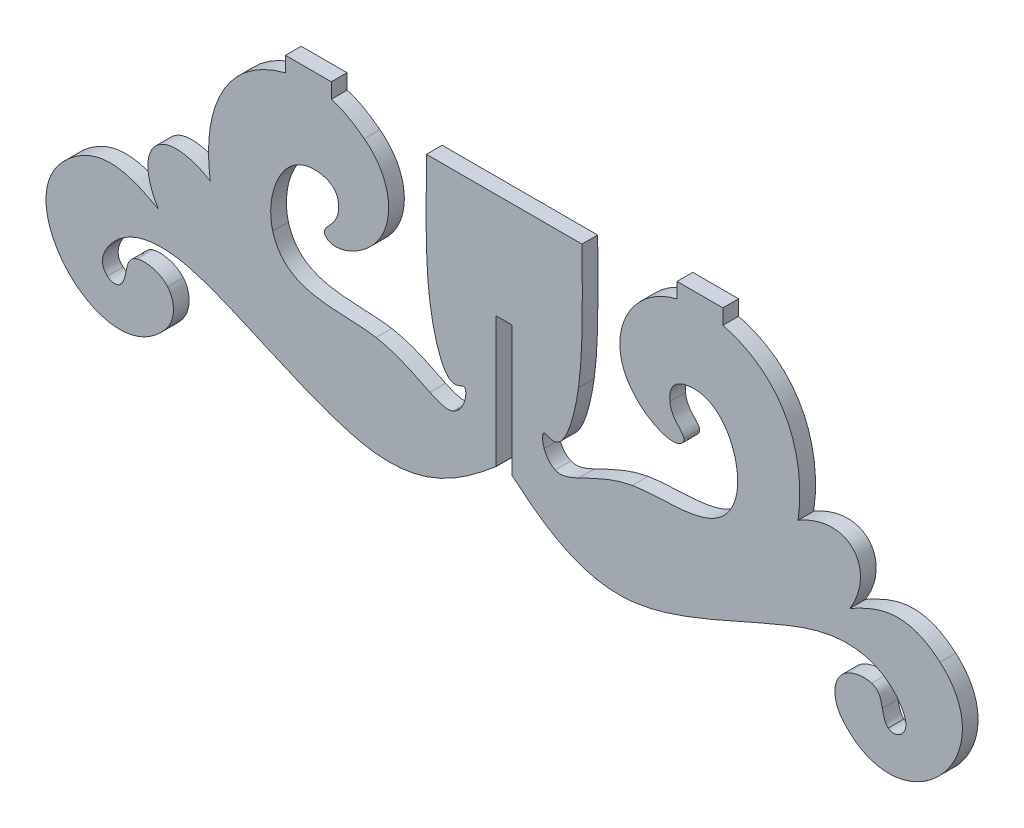
from build123d import *

# Parameters (mm, degrees)
RESSALTO_EXTRUS_O3_DEPTH = 2


with BuildPart() as part:
    # Model → Ressalto-extrusão3 (new body)
    with BuildSketch(Plane.XY):
        with BuildLine():
            Line((2.6789, 71.0422), (4.7123, 71.0422))
            Line((4.7123, 71.0422), (4.7123, 54.4506))
            Line((4.7123, 54.4506), (4.6872, 54.4506))
            add(Edge.make_bspline(
                [(4.6872, 54.4506), (9.062, 50.7507), (13.7394, 47.386), (20.3781, 48.2488)],
                knots=[0.027777778, 0.027777778, 0.027777778, 0.027777778, 0.041666667, 0.041666667, 0.041666667, 0.041666667], degree=3))
            add(Edge.make_bspline(
                [(20.3781, 48.2488), (27.5885, 49.1858), (37.2734, 55.11), (43.5948, 56.7666)],
                knots=[0.041666667, 0.041666667, 0.041666667, 0.041666667, 0.055555556, 0.055555556, 0.055555556, 0.055555556], degree=3))
            add(Edge.make_bspline(
                [(43.5948, 56.7666), (49.9162, 58.4234), (52.8741, 55.8127), (54.0948, 54.0027)],
                knots=[0.055555556, 0.055555556, 0.055555556, 0.055555556, 0.069444444, 0.069444444, 0.069444444, 0.069444444], degree=3))
            add(Edge.make_bspline(
                [(54.0948, 54.0027), (55.3154, 52.1926), (54.7989, 51.1833), (54.2189, 50.6878)],
                knots=[0.069444444, 0.069444444, 0.069444444, 0.069444444, 0.083333333, 0.083333333, 0.083333333, 0.083333333], degree=3))
            add(Edge.make_bspline(
                [(54.2189, 50.6878), (53.6389, 50.1923), (52.9955, 50.2106), (52.5865, 50.5521)],
                knots=[0.083333333, 0.083333333, 0.083333333, 0.083333333, 0.097222222, 0.097222222, 0.097222222, 0.097222222], degree=3))
            add(Edge.make_bspline(
                [(52.5865, 50.5521), (52.1774, 50.8936), (52.0028, 51.5583), (51.8381, 52.3634)],
                knots=[0.097222222, 0.097222222, 0.097222222, 0.097222222, 0.111111111, 0.111111111, 0.111111111, 0.111111111], degree=3))
            add(Edge.make_bspline(
                [(51.8381, 52.3634), (51.6733, 53.1686), (51.5184, 54.1141), (50.4808, 54.4478)],
                knots=[0.111111111, 0.111111111, 0.111111111, 0.111111111, 0.125, 0.125, 0.125, 0.125], degree=3))
            add(Edge.make_bspline(
                [(50.4808, 54.4478), (49.4432, 54.7814), (47.5229, 54.5032), (46.5324, 53.3213)],
                knots=[0.125, 0.125, 0.125, 0.125, 0.138888889, 0.138888889, 0.138888889, 0.138888889], degree=3))
            add(Edge.make_bspline(
                [(46.5324, 53.3213), (45.5419, 52.1394), (45.4813, 50.0538), (46.8609, 48.4462)],
                knots=[0.138888889, 0.138888889, 0.138888889, 0.138888889, 0.152777778, 0.152777778, 0.152777778, 0.152777778], degree=3))
            add(Edge.make_bspline(
                [(46.8609, 48.4462), (54.5024, 39.5417), (67.8873, 53.5286), (59.1979, 61.1094)],
                knots=[0.152777778, 0.152777778, 0.152777778, 0.152777778, 0.166666667, 0.166666667, 0.166666667, 0.166666667], degree=3))
            add(Edge.make_bspline(
                [(59.1979, 61.1094), (54.8331, 64.9174), (51.0322, 63.0994), (47.7303, 61.3186)],
                knots=[0.166666667, 0.166666667, 0.166666667, 0.166666667, 0.180555556, 0.180555556, 0.180555556, 0.180555556], degree=3))
            add(Edge.make_bspline(
                [(47.7303, 61.3186), (51.1536, 66.909), (47.6105, 71.4976), (41.1094, 67.7169)],
                knots=[0.180555556, 0.180555556, 0.180555556, 0.180555556, 0.194444444, 0.194444444, 0.194444444, 0.194444444], degree=3))
            add(Edge.make_bspline(
                [(41.1094, 67.7169), (42.1976, 75.1571), (39.464, 82.3954), (31.5377, 84.4254)],
                knots=[0.194444444, 0.194444444, 0.194444444, 0.194444444, 0.208333333, 0.208333333, 0.208333333, 0.208333333], degree=3))
            Line((31.5377, 84.4254), (31.5377, 86.3583))
            Line((31.5377, 86.3583), (25.7044, 86.3583))
            Line((25.7044, 86.3583), (25.7044, 84.4254))
            add(Edge.make_bspline(
                [(25.7044, 84.4254), (18.8302, 82.7817), (15.2664, 74.1022), (22.078, 69.5651)],
                knots=[0.25, 0.25, 0.25, 0.25, 0.263888889, 0.263888889, 0.263888889, 0.263888889], degree=3))
            add(Edge.make_bspline(
                [(22.078, 69.5651), (23.2846, 68.7615), (24.5438, 68.3933), (25.3837, 68.4581)],
                knots=[0.263888889, 0.263888889, 0.263888889, 0.263888889, 0.277777778, 0.277777778, 0.277777778, 0.277777778], degree=3))
            add(Edge.make_bspline(
                [(25.3837, 68.4581), (26.2235, 68.523), (26.6439, 69.0208), (26.5749, 69.4768)],
                knots=[0.277777778, 0.277777778, 0.277777778, 0.277777778, 0.291666667, 0.291666667, 0.291666667, 0.291666667], degree=3))
            add(Edge.make_bspline(
                [(26.5749, 69.4768), (26.4546, 70.2717), (24.9711, 70.8288), (24.7886, 72.6586)],
                knots=[0.291666667, 0.291666667, 0.291666667, 0.291666667, 0.305555556, 0.305555556, 0.305555556, 0.305555556], degree=3))
            add(Edge.make_bspline(
                [(24.7886, 72.6586), (24.5774, 74.7766), (26.0542, 75.6463), (28.0005, 75.5977)],
                knots=[0.305555556, 0.305555556, 0.305555556, 0.305555556, 0.319444444, 0.319444444, 0.319444444, 0.319444444], degree=3))
            add(Edge.make_bspline(
                [(28.0005, 75.5977), (32.2189, 75.4923), (34.1657, 69.6758), (33.1666, 66.1718)],
                knots=[0.319444444, 0.319444444, 0.319444444, 0.319444444, 0.333333333, 0.333333333, 0.333333333, 0.333333333], degree=3))
            add(Edge.make_bspline(
                [(33.1666, 66.1718), (31.4794, 60.2548), (24.54, 61.8192), (19.997, 61.0131)],
                knots=[0.333333333, 0.333333333, 0.333333333, 0.333333333, 0.347222222, 0.347222222, 0.347222222, 0.347222222], degree=3))
            add(Edge.make_bspline(
                [(19.997, 61.0131), (17.1907, 60.5153), (14.7474, 59.143), (13.1565, 58.3983)],
                knots=[0.347222222, 0.347222222, 0.347222222, 0.347222222, 0.361111111, 0.361111111, 0.361111111, 0.361111111], degree=3))
            add(Edge.make_bspline(
                [(13.1565, 58.3983), (11.5657, 57.6536), (10.8273, 57.5364), (10.1985, 57.8083)],
                knots=[0.361111111, 0.361111111, 0.361111111, 0.361111111, 0.375, 0.375, 0.375, 0.375], degree=3))
            add(Edge.make_bspline(
                [(10.1985, 57.8083), (9.5697, 58.0801), (9.0504, 58.7408), (8.7848, 59.4751)],
                knots=[0.375, 0.375, 0.375, 0.375, 0.388888889, 0.388888889, 0.388888889, 0.388888889], degree=3))
            add(Edge.make_bspline(
                [(8.7848, 59.4751), (8.5191, 60.2093), (8.507, 61.0171), (8.775, 61.1741)],
                knots=[0.388888889, 0.388888889, 0.388888889, 0.388888889, 0.402777778, 0.402777778, 0.402777778, 0.402777778], degree=3))
            add(Edge.make_bspline(
                [(8.775, 61.1741), (9.043, 61.3311), (9.8672, 60.4358), (10.7531, 61.1993)],
                knots=[0.402777778, 0.402777778, 0.402777778, 0.402777778, 0.416666667, 0.416666667, 0.416666667, 0.416666667], degree=3))
            add(Edge.make_bspline(
                [(10.7531, 61.1993), (11.639, 61.9629), (12.5865, 64.3852), (13.1576, 68.364)],
                knots=[0.416666667, 0.416666667, 0.416666667, 0.416666667, 0.430555556, 0.430555556, 0.430555556, 0.430555556], degree=3))
            add(Edge.make_bspline(
                [(13.1576, 68.364), (13.7287, 72.3427), (13.6784, 78.4807), (13.5969, 84.4174)],
                knots=[0.430555556, 0.430555556, 0.430555556, 0.430555556, 0.444444444, 0.444444444, 0.444444444, 0.444444444], degree=3))
            Line((13.5969, 84.4174), (9.529, 84.4174))
            Line((9.529, 84.4174), (-2.1377, 84.4174))
            Line((-2.1377, 84.4174), (-6.2057, 84.4174))
            add(Edge.make_bspline(
                [(-6.2057, 84.4174), (-6.2872, 78.4807), (-6.3375, 72.3427), (-5.7664, 68.364)],
                knots=[0.513888889, 0.513888889, 0.513888889, 0.513888889, 0.527777778, 0.527777778, 0.527777778, 0.527777778], degree=3))
            add(Edge.make_bspline(
                [(-5.7664, 68.364), (-5.1953, 64.3852), (-4.2478, 61.9629), (-3.3619, 61.1993)],
                knots=[0.527777778, 0.527777778, 0.527777778, 0.527777778, 0.541666667, 0.541666667, 0.541666667, 0.541666667], degree=3))
            add(Edge.make_bspline(
                [(-3.3619, 61.1993), (-2.476, 60.4358), (-1.6518, 61.3311), (-1.3838, 61.1741)],
                knots=[0.541666667, 0.541666667, 0.541666667, 0.541666667, 0.555555556, 0.555555556, 0.555555556, 0.555555556], degree=3))
            add(Edge.make_bspline(
                [(-1.3838, 61.1741), (-1.1158, 61.0171), (-1.1279, 60.2093), (-1.3936, 59.4751)],
                knots=[0.555555556, 0.555555556, 0.555555556, 0.555555556, 0.569444444, 0.569444444, 0.569444444, 0.569444444], degree=3))
            add(Edge.make_bspline(
                [(-1.3936, 59.4751), (-1.6592, 58.7408), (-2.1785, 58.0801), (-2.8073, 57.8083)],
                knots=[0.569444444, 0.569444444, 0.569444444, 0.569444444, 0.583333333, 0.583333333, 0.583333333, 0.583333333], degree=3))
            add(Edge.make_bspline(
                [(-2.8073, 57.8083), (-3.4361, 57.5364), (-4.1745, 57.6536), (-5.7653, 58.3983)],
                knots=[0.583333333, 0.583333333, 0.583333333, 0.583333333, 0.597222222, 0.597222222, 0.597222222, 0.597222222], degree=3))
            add(Edge.make_bspline(
                [(-5.7653, 58.3983), (-7.3562, 59.143), (-9.7995, 60.5153), (-12.6058, 61.0131)],
                knots=[0.597222222, 0.597222222, 0.597222222, 0.597222222, 0.611111111, 0.611111111, 0.611111111, 0.611111111], degree=3))
            add(Edge.make_bspline(
                [(-12.6058, 61.0131), (-17.1488, 61.8192), (-24.0882, 60.2548), (-25.7754, 66.1718)],
                knots=[0.611111111, 0.611111111, 0.611111111, 0.611111111, 0.625, 0.625, 0.625, 0.625], degree=3))
            add(Edge.make_bspline(
                [(-25.7754, 66.1718), (-26.7745, 69.6758), (-24.8277, 75.4923), (-20.6093, 75.5977)],
                knots=[0.625, 0.625, 0.625, 0.625, 0.638888889, 0.638888889, 0.638888889, 0.638888889], degree=3))
            add(Edge.make_bspline(
                [(-20.6093, 75.5977), (-18.663, 75.6463), (-17.1862, 74.7766), (-17.3974, 72.6586)],
                knots=[0.638888889, 0.638888889, 0.638888889, 0.638888889, 0.652777778, 0.652777778, 0.652777778, 0.652777778], degree=3))
            add(Edge.make_bspline(
                [(-17.3974, 72.6586), (-17.5799, 70.8288), (-19.0634, 70.2717), (-19.1837, 69.4768)],
                knots=[0.652777778, 0.652777778, 0.652777778, 0.652777778, 0.666666667, 0.666666667, 0.666666667, 0.666666667], degree=3))
            add(Edge.make_bspline(
                [(-19.1837, 69.4768), (-19.2527, 69.0208), (-18.8323, 68.523), (-17.9925, 68.4581)],
                knots=[0.666666667, 0.666666667, 0.666666667, 0.666666667, 0.680555556, 0.680555556, 0.680555556, 0.680555556], degree=3))
            add(Edge.make_bspline(
                [(-17.9925, 68.4581), (-17.1526, 68.3933), (-15.8934, 68.7615), (-14.6868, 69.5651)],
                knots=[0.680555556, 0.680555556, 0.680555556, 0.680555556, 0.694444444, 0.694444444, 0.694444444, 0.694444444], degree=3))
            add(Edge.make_bspline(
                [(-14.6868, 69.5651), (-10.0229, 72.6717), (-9.7672, 78.8737), (-14.1156, 82.1811)],
                knots=[0.694444444, 0.694444444, 0.694444444, 0.694444444, 0.708333333, 0.708333333, 0.708333333, 0.708333333], degree=3))
            add(Edge.make_bspline(
                [(-14.1156, 82.1811), (-15.2489, 83.0431), (-16.7518, 84.052), (-18.3132, 84.4254)],
                knots=[0.708333333, 0.708333333, 0.708333333, 0.708333333, 0.722222222, 0.722222222, 0.722222222, 0.722222222], degree=3))
            Line((-18.3132, 84.4254), (-18.3132, 86.3598))
            Line((-18.3132, 86.3598), (-24.1465, 86.3598))
            Line((-24.1465, 86.3598), (-24.1465, 84.4254))
            add(Edge.make_bspline(
                [(-24.1465, 84.4254), (-32.0728, 82.3954), (-34.8065, 75.1571), (-33.7182, 67.7169)],
                knots=[0.763888889, 0.763888889, 0.763888889, 0.763888889, 0.777777778, 0.777777778, 0.777777778, 0.777777778], degree=3))
            add(Edge.make_bspline(
                [(-33.7182, 67.7169), (-40.2193, 71.4976), (-43.7624, 66.909), (-40.3391, 61.3186)],
                knots=[0.777777778, 0.777777778, 0.777777778, 0.777777778, 0.791666667, 0.791666667, 0.791666667, 0.791666667], degree=3))
            add(Edge.make_bspline(
                [(-40.3391, 61.3186), (-43.641, 63.0994), (-47.4419, 64.9174), (-51.8067, 61.1094)],
                knots=[0.791666667, 0.791666667, 0.791666667, 0.791666667, 0.805555556, 0.805555556, 0.805555556, 0.805555556], degree=3))
            add(Edge.make_bspline(
                [(-51.8067, 61.1094), (-60.4961, 53.5286), (-47.1112, 39.5417), (-39.4697, 48.4462)],
                knots=[0.805555556, 0.805555556, 0.805555556, 0.805555556, 0.819444444, 0.819444444, 0.819444444, 0.819444444], degree=3))
            add(Edge.make_bspline(
                [(-39.4697, 48.4462), (-38.0901, 50.0538), (-38.1507, 52.1394), (-39.1412, 53.3213)],
                knots=[0.819444444, 0.819444444, 0.819444444, 0.819444444, 0.833333333, 0.833333333, 0.833333333, 0.833333333], degree=3))
            add(Edge.make_bspline(
                [(-39.1412, 53.3213), (-40.1317, 54.5032), (-42.052, 54.7814), (-43.0896, 54.4478)],
                knots=[0.833333333, 0.833333333, 0.833333333, 0.833333333, 0.847222222, 0.847222222, 0.847222222, 0.847222222], degree=3))
            add(Edge.make_bspline(
                [(-43.0896, 54.4478), (-44.1272, 54.1141), (-44.2821, 53.1686), (-44.4469, 52.3634)],
                knots=[0.847222222, 0.847222222, 0.847222222, 0.847222222, 0.861111111, 0.861111111, 0.861111111, 0.861111111], degree=3))
            add(Edge.make_bspline(
                [(-44.4469, 52.3634), (-44.6116, 51.5583), (-44.7862, 50.8936), (-45.1953, 50.5521)],
                knots=[0.861111111, 0.861111111, 0.861111111, 0.861111111, 0.875, 0.875, 0.875, 0.875], degree=3))
            add(Edge.make_bspline(
                [(-45.1953, 50.5521), (-45.6043, 50.2106), (-46.2477, 50.1923), (-46.8277, 50.6878)],
                knots=[0.875, 0.875, 0.875, 0.875, 0.888888889, 0.888888889, 0.888888889, 0.888888889], degree=3))
            add(Edge.make_bspline(
                [(-46.8277, 50.6878), (-47.4077, 51.1833), (-47.9242, 52.1926), (-46.7036, 54.0027)],
                knots=[0.888888889, 0.888888889, 0.888888889, 0.888888889, 0.902777778, 0.902777778, 0.902777778, 0.902777778], degree=3))
            add(Edge.make_bspline(
                [(-46.7036, 54.0027), (-45.4829, 55.8127), (-42.525, 58.4234), (-36.2036, 56.7666)],
                knots=[0.902777778, 0.902777778, 0.902777778, 0.902777778, 0.916666667, 0.916666667, 0.916666667, 0.916666667], degree=3))
            add(Edge.make_bspline(
                [(-36.2036, 56.7666), (-29.8822, 55.11), (-20.1973, 49.1858), (-12.9869, 48.2488)],
                knots=[0.916666667, 0.916666667, 0.916666667, 0.916666667, 0.930555556, 0.930555556, 0.930555556, 0.930555556], degree=3))
            add(Edge.make_bspline(
                [(-12.9869, 48.2488), (-6.3481, 47.386), (-1.6708, 50.7507), (2.704, 54.4506)],
                knots=[0.930555556, 0.930555556, 0.930555556, 0.930555556, 0.944444444, 0.944444444, 0.944444444, 0.944444444], degree=3))
            Line((2.704, 54.4506), (2.6789, 54.4506))
            Line((2.6789, 54.4506), (2.6789, 71.0422))
        make_face()
    extrude(amount=RESSALTO_EXTRUS_O3_DEPTH)


solid = part.part
